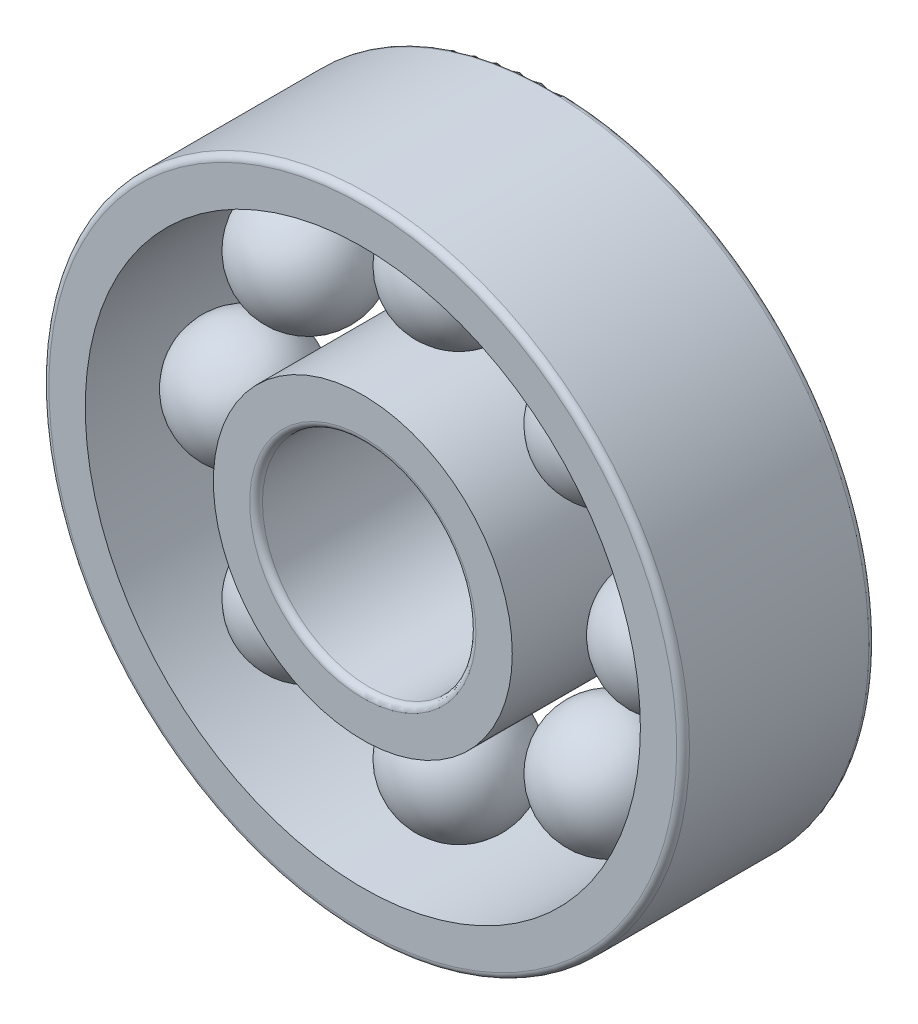
from build123d import *

# Parameters (mm, degrees)
INNERS_W           = 2
INNERS_H           = 9
OUTERS_W           = 2
OUTERS_H           = 9
BALLSPATTERN_COUNT = 8
FILLET_F1_R        = 0.3
FILLET_F2_R        = 0.3


with BuildPart() as part:
    # InnerS → InnerRing (revolve)
    with BuildSketch(Plane(origin=(0, 0, 0), x_dir=(1, 0, 0), z_dir=(0, 1, 0))):
        with Locations((6, 0)):
            Rectangle(INNERS_W, INNERS_H)
    revolve(axis=Axis((0, 0, 7.75), (0, 0, -1)))

    # Fillet F1
    fillet_f1_edges = [part.edges().sort_by_distance(p)[0] for p in [
        (-5, 0, -4.5),
        (-5, 0, 4.5),
    ]]
    fillet(fillet_f1_edges, radius=FILLET_F1_R)


with BuildPart() as body_2:
    # OuterS → OuterRing (revolve)
    with BuildSketch(Plane(origin=(0, 0, 0), x_dir=(1, 0, 0), z_dir=(0, 1, 0))):
        with Locations((14, 0)):
            Rectangle(OUTERS_W, OUTERS_H)
    revolve(axis=Axis((0, 0, 7.75), (0, 0, -1)))

    # Fillet F2
    fillet_f2_edges = [body_2.edges().sort_by_distance(p)[0] for p in [
        (-15, 0, -4.5),
        (-15, 0, 4.5),
    ]]
    fillet(fillet_f2_edges, radius=FILLET_F2_R)


with BuildPart() as body_3:
    # BallS → Ball (revolve)
    with BuildSketch(Plane(origin=(0, 0, 0), x_dir=(1, 0, 0), z_dir=(0, 1, 0))):
        with BuildLine():
            Line((7.15, 0), (12.85, 0))
            ThreePointArc((12.85, 0), (10, -2.85), (7.15, 0))
        make_face()
    revolve(axis=Axis((7.15, 0, 0), (1, 0, 0)))


with BuildPart() as ballspattern_1:
    # BallsPattern: pattern copy
    add(body_3.part.rotate(Axis((0, 0, -4.95), (0, 0, 1)), 1 * 360 / BALLSPATTERN_COUNT))


with BuildPart() as ballspattern_2:
    # BallsPattern: pattern copy
    add(body_3.part.rotate(Axis((0, 0, -4.95), (0, 0, 1)), 2 * 360 / BALLSPATTERN_COUNT))


with BuildPart() as ballspattern_3:
    # BallsPattern: pattern copy
    add(body_3.part.rotate(Axis((0, 0, -4.95), (0, 0, 1)), 3 * 360 / BALLSPATTERN_COUNT))


with BuildPart() as ballspattern_4:
    # BallsPattern: pattern copy
    add(body_3.part.rotate(Axis((0, 0, -4.95), (0, 0, 1)), 4 * 360 / BALLSPATTERN_COUNT))


with BuildPart() as ballspattern_5:
    # BallsPattern: pattern copy
    add(body_3.part.rotate(Axis((0, 0, -4.95), (0, 0, 1)), 5 * 360 / BALLSPATTERN_COUNT))


with BuildPart() as ballspattern_6:
    # BallsPattern: pattern copy
    add(body_3.part.rotate(Axis((0, 0, -4.95), (0, 0, 1)), 6 * 360 / BALLSPATTERN_COUNT))


with BuildPart() as ballspattern_7:
    # BallsPattern: pattern copy
    add(body_3.part.rotate(Axis((0, 0, -4.95), (0, 0, 1)), 7 * 360 / BALLSPATTERN_COUNT))


solid = Compound([part.part, body_2.part, body_3.part, ballspattern_1.part, ballspattern_2.part, ballspattern_3.part, ballspattern_4.part, ballspattern_5.part, ballspattern_6.part, ballspattern_7.part])
